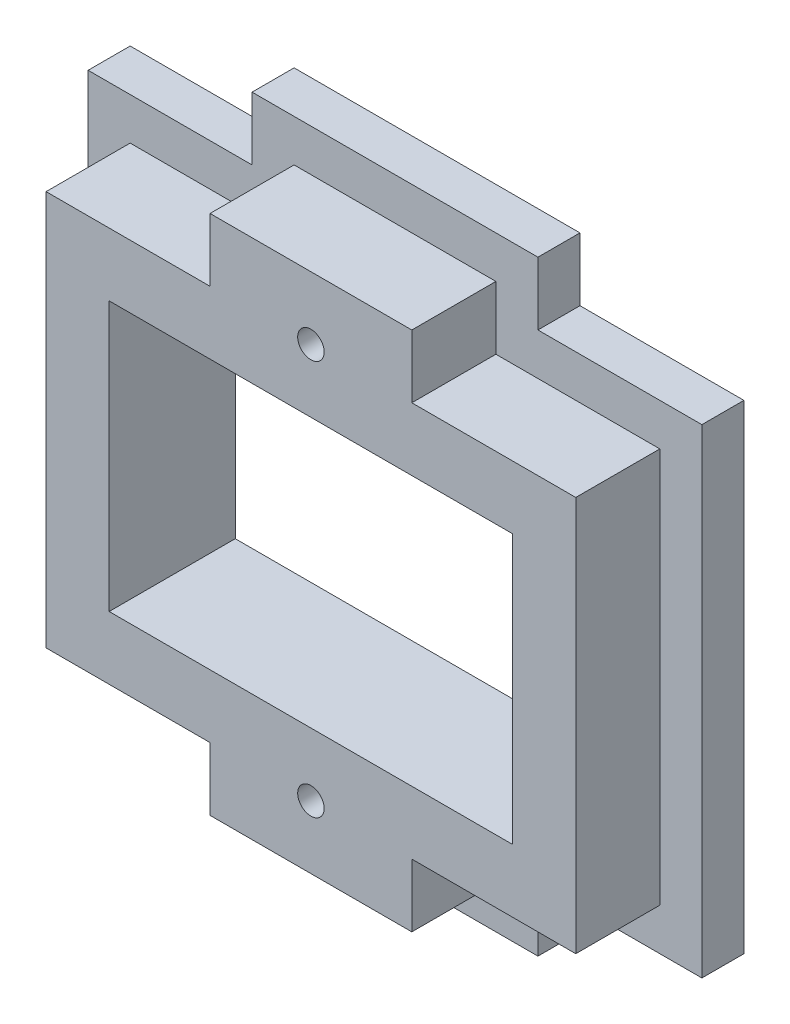
from build123d import *

# Parameters (mm, degrees)
SKETCH1_R           = 0.5
SKETCH1_W           = 15.24
SKETCH1_H           = 10.16
BOSS_EXTRUDE1_DEPTH = 3.175
SKETCH2_W           = 15.24
SKETCH2_H           = 10.16
BOSS_EXTRUDE2_DEPTH = 1.5875


with BuildPart() as part:
    # Sketch1 → Boss-Extrude1 (new body)
    with BuildSketch(Plane.XY):
        Polygon((3.81, -7.46125), (10.00125, -7.46125), (10.00125, 7.46125), (3.81, 7.46125), (3.81, 9.8425), (-3.81, 9.8425), (-3.81, 7.46125), (-10.00125, 7.46125), (-10.00125, -7.46125), (-3.81, -7.46125), (-3.81, -9.8425), (3.81, -9.8425), align=None)
        with Locations((0, 7.46125)):
            Circle(SKETCH1_R, mode=Mode.SUBTRACT)
        with Locations((0, -7.46125)):
            Circle(SKETCH1_R, mode=Mode.SUBTRACT)
        Rectangle(SKETCH1_W, SKETCH1_H, mode=Mode.SUBTRACT)
    extrude(amount=BOSS_EXTRUDE1_DEPTH)

    # Sketch2 → Boss-Extrude2 (add)
    with BuildSketch(Plane(origin=(0, 0, 0), x_dir=(-1, 0, 0), z_dir=(0, 0, -1))):
        Polygon((5.3975, -9.04875), (11.58875, -9.04875), (11.58875, 9.04875), (5.3975, 9.04875), (5.3975, 11.43), (-5.3975, 11.43), (-5.3975, 9.04875), (-11.58875, 9.04875), (-11.58875, -9.04875), (-5.3975, -9.04875), (-5.3975, -11.43), (5.3975, -11.43), align=None)
        Rectangle(SKETCH2_W, SKETCH2_H, mode=Mode.SUBTRACT)
    extrude(amount=BOSS_EXTRUDE2_DEPTH)


solid = part.part
